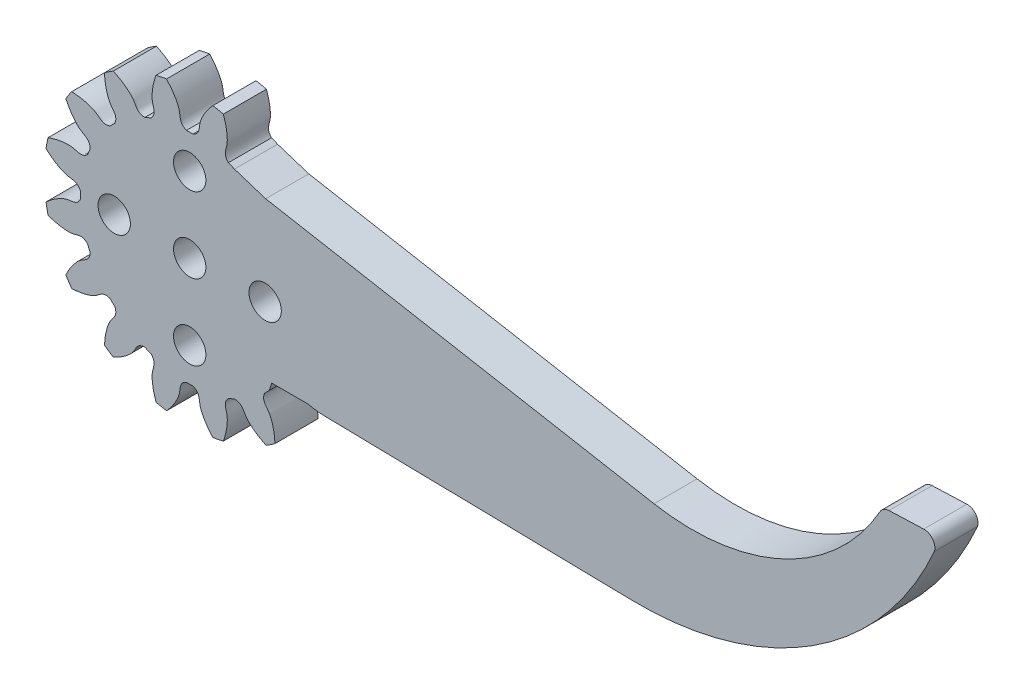
from build123d import *

# Parameters (mm, degrees)
SKETCH_1_R               = 13.5
EXTRUDE_1_DEPTH          = 4
CUT_EXTRUDE_1_DEPTH      = 20.506409203
PATTERN_CIRCULAR_1_COUNT = 16
EXTRUDE_2_DEPTH          = 4
CUT_EXTRUDE_START        = -5
CUT_EXTRUDE_2_DEPTH      = 5
SKETCH_6_R               = 1.5
CUT_EXTRUDE_3_DEPTH      = 5


with BuildPart() as part:
    # 草图1 → 凸台-拉伸1 (new body)
    with BuildSketch(Plane.XY):
        Circle(SKETCH_1_R)
    extrude(amount=EXTRUDE_1_DEPTH)

    # 草图2 → 切除-拉伸1 (cut, through all)
    with BuildSketch(Plane.XY):
        with BuildLine():
            ThreePointArc((0.305041185, 10.120403889), (0, 10.125), (-0.305041185, 10.120403889))
            add(Edge.make_bspline(
                [(-0.305041185, 10.120403889), (-0.962759204, 10.395183014), (-0.853981794, 10.906049427), (-0.967171932, 11.380214888), (-0.976804181, 11.417326349), (-0.988398148, 11.458580344), (-1.002118436, 11.503912359), (-1.018133663, 11.553251857), (-1.036608616, 11.606523545), (-1.057706516, 11.663647046), (-1.081588151, 11.724537072), (-1.108411962, 11.789103449), (-1.138333851, 11.857251186), (-1.171507068, 11.928880543), (-1.208082076, 12.003887096), (-1.248206435, 12.082161811), (-1.292024667, 12.16359112), (-1.339678142, 12.248056998), (-1.391304957, 12.335437043), (-1.447039812, 12.425604566), (-1.507013901, 12.518428671), (-1.571354794, 12.61377435), (-1.640186328, 12.711502576), (-1.713628495, 12.811470397), (-1.791797335, 12.913531035), (-1.874804837, 13.01753399), (-1.962758827, 13.123325139), (-2.055762878, 13.230746851), (-2.153916207, 13.339638085), (-2.257313584, 13.449834512), (-2.366045239, 13.561168623), (-2.480196773, 13.673469848), (-2.599849074, 13.786564671), (-2.725078231, 13.900276757), (-2.855955457, 14.01442707), (-2.99254701, 14.128833999), (-3.13491412, 14.243313486), (-3.283112918, 14.357679154), (-3.437194369, 14.471742441), (-3.597204206, 14.585312725), (-3.763182868, 14.698197468), (-3.935165451, 14.810202343), (-4.113181617, 14.92113138), (-4.361197206, 15.068878017), (-4.552482445, 15.175112164), (-4.682669973, 15.244113675)],
                knots=[0, 0, 0, 0, 0.200958108, 0.205848205, 0.211390316, 0.217584439, 0.224430575, 0.231928724, 0.240078886, 0.248881062, 0.25833525, 0.268441451, 0.279199665, 0.290609892, 0.302672132, 0.315386384, 0.32875265, 0.342770929, 0.357441221, 0.372763526, 0.388737843, 0.405364174, 0.422642518, 0.440572874, 0.459155244, 0.478389626, 0.498276022, 0.51881443, 0.540004852, 0.561847286, 0.584341734, 0.607488194, 0.631286667, 0.655737153, 0.680839653, 0.706594165, 0.73300069, 0.760059228, 0.787769779, 0.816132343, 0.84514692, 0.87481351, 0.905132113, 0.936102729, 1, 1, 1, 1], degree=3))
            ThreePointArc((-4.682669973, 15.244113675), (0, 15.947112585), (4.682669973, 15.244113675))
            add(Edge.make_bspline(
                [(0.305041185, 10.120403889), (0.962759204, 10.395183014), (0.853981794, 10.906049427), (0.967171932, 11.380214888), (0.976804181, 11.417326349), (0.988398148, 11.458580344), (1.002118436, 11.503912359), (1.018133663, 11.553251857), (1.036608616, 11.606523545), (1.057706516, 11.663647046), (1.081588151, 11.724537072), (1.108411962, 11.789103449), (1.138333851, 11.857251186), (1.171507068, 11.928880543), (1.208082076, 12.003887096), (1.248206435, 12.082161811), (1.292024667, 12.16359112), (1.339678142, 12.248056998), (1.391304957, 12.335437043), (1.447039812, 12.425604566), (1.507013901, 12.518428671), (1.571354794, 12.61377435), (1.640186328, 12.711502576), (1.713628495, 12.811470397), (1.791797335, 12.913531035), (1.874804837, 13.01753399), (1.962758827, 13.123325139), (2.055762878, 13.230746851), (2.153916207, 13.339638085), (2.257313584, 13.449834512), (2.366045239, 13.561168623), (2.480196773, 13.673469848), (2.599849074, 13.786564671), (2.725078231, 13.900276757), (2.855955457, 14.01442707), (2.99254701, 14.128833999), (3.13491412, 14.243313486), (3.283112918, 14.357679154), (3.437194369, 14.471742441), (3.597204206, 14.585312725), (3.763182868, 14.698197468), (3.935165451, 14.810202343), (4.113181617, 14.92113138), (4.361197206, 15.068878017), (4.552482445, 15.175112164), (4.682669973, 15.244113675)],
                knots=[0, 0, 0, 0, 0.200958108, 0.205848205, 0.211390316, 0.217584439, 0.224430575, 0.231928724, 0.240078886, 0.248881062, 0.25833525, 0.268441451, 0.279199665, 0.290609892, 0.302672132, 0.315386384, 0.32875265, 0.342770929, 0.357441221, 0.372763526, 0.388737843, 0.405364174, 0.422642518, 0.440572874, 0.459155244, 0.478389626, 0.498276022, 0.51881443, 0.540004852, 0.561847286, 0.584341734, 0.607488194, 0.631286667, 0.655737153, 0.680839653, 0.706594165, 0.73300069, 0.760059228, 0.787769779, 0.816132343, 0.84514692, 0.87481351, 0.905132113, 0.936102729, 1, 1, 1, 1], degree=3))
        make_face()
    cut_extrude_1 = extrude(amount=CUT_EXTRUDE_1_DEPTH, mode=Mode.SUBTRACT)

    # 阵列(圆周)1: 切除-拉伸1 ×16 about axis
    pattern_circular_1_axis = Axis((0, 0, -1.5), (0, 0, 1))
    for i in range(1, PATTERN_CIRCULAR_1_COUNT):
        add(cut_extrude_1.rotate(pattern_circular_1_axis, i * 360 / PATTERN_CIRCULAR_1_COUNT), mode=Mode.SUBTRACT)

    # 草图4 → 凸台-拉伸2 (add)
    with BuildSketch(Plane.XY.offset(4)):
        with BuildLine():
            Line((7.048166419, 8.298390168), (0, 0))
            Line((0, 0), (9.477110382, -5.584297522))
            ThreePointArc((9.477110382, -5.584297522), (10.894737078, -6.193579434), (12.420873421, -6.421170646))
            Line((12.420873421, -6.421170646), (41.024266552, -6.967464209))
            ThreePointArc((41.024266552, -6.967464209), (57.76893273, -2.240953037), (69.074055543, 10.984702013))
            ThreePointArc((69.074055543, 10.984702013), (68.914065372, 11.890076303), (68.08245999, 12.282162966))
            Line((68.08245999, 12.282162966), (64.860522217, 12.162624029))
            ThreePointArc((64.860522217, 12.162624029), (64.377621093, 12.017491734), (64.026927744, 11.655178261))
            ThreePointArc((64.026927744, 11.655178261), (55.117123619, 3.390338558), (43.067528951, 1.809372658))
            Line((43.067528951, 1.809372658), (7.048166419, 8.298390168))
        make_face()
    extrude(amount=-EXTRUDE_2_DEPTH)

    # 草图5 → 切除-拉伸2 (cut)
    with BuildSketch(Plane.XY.offset(4).offset(CUT_EXTRUDE_START)):
        with BuildLine():
            Line((9.906103197, 7.783522594), (11.189888754, 7.552244015))
            ThreePointArc((11.189888754, 7.552244015), (11.066922769, 7.731314275), (10.94109142, 7.908382802))
            add(Edge.make_bspline(
                [(9.906103197, 7.783522594), (9.985995534, 7.800032282), (10.149067957, 7.830050687), (10.402556373, 7.86609749), (10.667530032, 7.89303273), (10.849300154, 7.904366775), (10.94109142, 7.908382802)],
                knots=[0.387264301, 0.387264301, 0.387264301, 0.387264301, 0.422642518, 0.459155244, 0.498276022, 0.538120392, 0.538120392, 0.538120392, 0.538120392], degree=3))
        make_face()
        with BuildLine():
            Line((7.048166424, 8.298390174), (4.154732205, 9.233299806))
            add(Edge.make_bspline(
                [(4.154732205, 9.233299806), (4.867537839, 9.235464826), (4.962540728, 9.749071162), (5.25695123, 10.155394002), (5.300647022, 10.211900205), (5.364430121, 10.287943264), (5.443318377, 10.374748767), (5.538256848, 10.471207694), (5.650123041, 10.576155048), (5.779726765, 10.688371467), (5.927806493, 10.806587349), (6.095026836, 10.929486509), (6.28197599, 11.055710125), (6.489163436, 11.183860762), (6.717017827, 11.312506521), (6.917195178, 11.415205381), (7.041497539, 11.474549412), (7.081843351, 11.493367424)],
                knots=[0, 0, 0, 0, 0.200958108, 0.205848205, 0.217584439, 0.231928724, 0.248881062, 0.268441451, 0.290609892, 0.315386384, 0.342770929, 0.372763526, 0.405364174, 0.440572874, 0.478389626, 0.51881443, 0.538120392, 0.538120392, 0.538120392, 0.538120392], degree=3))
            ThreePointArc((7.081843351, 11.493367424), (7.500198146, 11.224839766), (7.908382802, 10.94109142))
            add(Edge.make_bspline(
                [(7.908382802, 10.94109142), (7.902362368, 10.803486972), (7.886288643, 10.579024709), (7.84924484, 10.2750834), (7.810136244, 10.034626075), (7.765063197, 9.81360387), (7.715511649, 9.612080932), (7.6629621, 9.430033821), (7.608884873, 9.267352204), (7.554735561, 9.123839655), (7.509281757, 9.016523732), (7.46682518, 8.924338926), (7.434759883, 8.859669135), (7.397505105, 8.790075329), (7.370612523, 8.743090679), (7.263086216, 8.568130855), (7.14298493, 8.433173736), (7.048166424, 8.298390174)],
                knots=[0.461879608, 0.461879608, 0.461879608, 0.461879608, 0.521610374, 0.559427126, 0.594635826, 0.627236474, 0.657229071, 0.684613616, 0.709390108, 0.731558549, 0.751118938, 0.759921114, 0.775569425, 0.782415561, 0.794151795, 0.799041892, 0.871466254, 0.871466254, 0.871466254, 0.871466254], degree=3))
        make_face()
        with BuildLine():
            Line((7.371902909, -6.940509527), (7.602379893, -6.227210648))
            Line((7.602379893, -6.227210648), (11.018013282, -6.227210648))
            add(Edge.make_bspline(
                [(11.018013282, -6.227210648), (11.07397889, -6.311692627), (11.173952787, -6.471615019), (11.312506541, -6.717017789), (11.415205381, -6.917195178), (11.474549412, -7.041497539), (11.493367424, -7.081843351)],
                knots=[0.396626604, 0.396626604, 0.396626604, 0.396626604, 0.440572874, 0.478389626, 0.51881443, 0.538120392, 0.538120392, 0.538120392, 0.538120392], degree=3))
            ThreePointArc((11.493367424, -7.081843351), (11.224839766, -7.500198146), (10.94109142, -7.908382802))
            add(Edge.make_bspline(
                [(10.94109142, -7.908382802), (10.803486972, -7.902362368), (10.579024709, -7.886288643), (10.2750834, -7.84924484), (10.034626075, -7.810136244), (9.81360387, -7.765063197), (9.612080932, -7.715511649), (9.430033821, -7.6629621), (9.267352204, -7.608884873), (9.123839655, -7.554735561), (9.016523732, -7.509281757), (8.924338926, -7.46682518), (8.859669135, -7.434759883), (8.790075329, -7.397505105), (8.743090679, -7.370612523), (8.315597823, -7.107885188), (8.031277963, -6.669730839), (7.371902909, -6.940509527)],
                knots=[0.461879608, 0.461879608, 0.461879608, 0.461879608, 0.521610374, 0.559427126, 0.594635826, 0.627236474, 0.657229071, 0.684613616, 0.709390108, 0.731558549, 0.751118938, 0.759921114, 0.775569425, 0.782415561, 0.794151795, 0.799041892, 1, 1, 1, 1], degree=3))
        make_face()
    extrude(amount=CUT_EXTRUDE_2_DEPTH, mode=Mode.SUBTRACT)

    # 草图6 → 切除-拉伸3 (cut)
    with BuildSketch(Plane.XY.offset(4)):
        with Locations((0, 7)):
            Circle(SKETCH_6_R)
        with Locations((7, 0)):
            Circle(SKETCH_6_R)
        with Locations((0, -7)):
            Circle(SKETCH_6_R)
        with Locations((-7, 0)):
            Circle(SKETCH_6_R)
        Circle(SKETCH_6_R)
    extrude(amount=-CUT_EXTRUDE_3_DEPTH, mode=Mode.SUBTRACT)


solid = part.part
